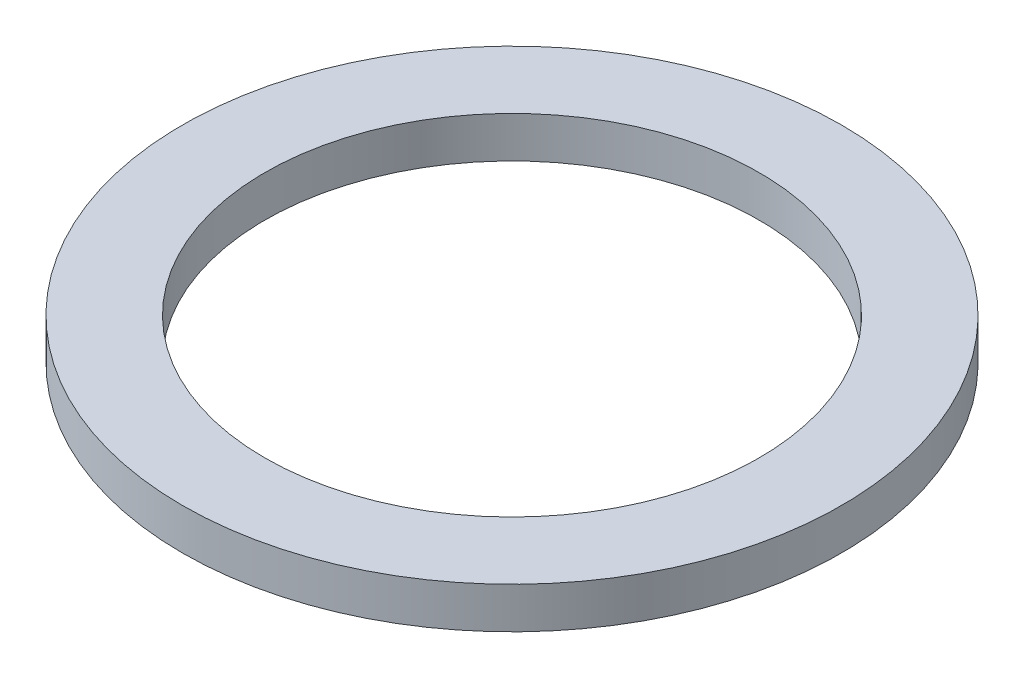
from build123d import *

# Parameters (mm, degrees)
SKETCH1_R           = 50.8
SKETCH1_R_2         = 38.1
BOSS_EXTRUDE1_DEPTH = 3.175


with BuildPart() as part:
    # Sketch1 → Boss-Extrude1 (new, symmetric)
    with BuildSketch(Plane(origin=(0, 0, 0), x_dir=(1, 0, 0), z_dir=(0, 1, 0))):
        with Locations(Location((0, 0, 0), (0, 0, 270))):
            Circle(SKETCH1_R)
        with Locations(Location((0, 0, 0), (0, 0, 270))):
            Circle(SKETCH1_R_2, mode=Mode.SUBTRACT)
    extrude(amount=BOSS_EXTRUDE1_DEPTH, both=True)


solid = part.part
